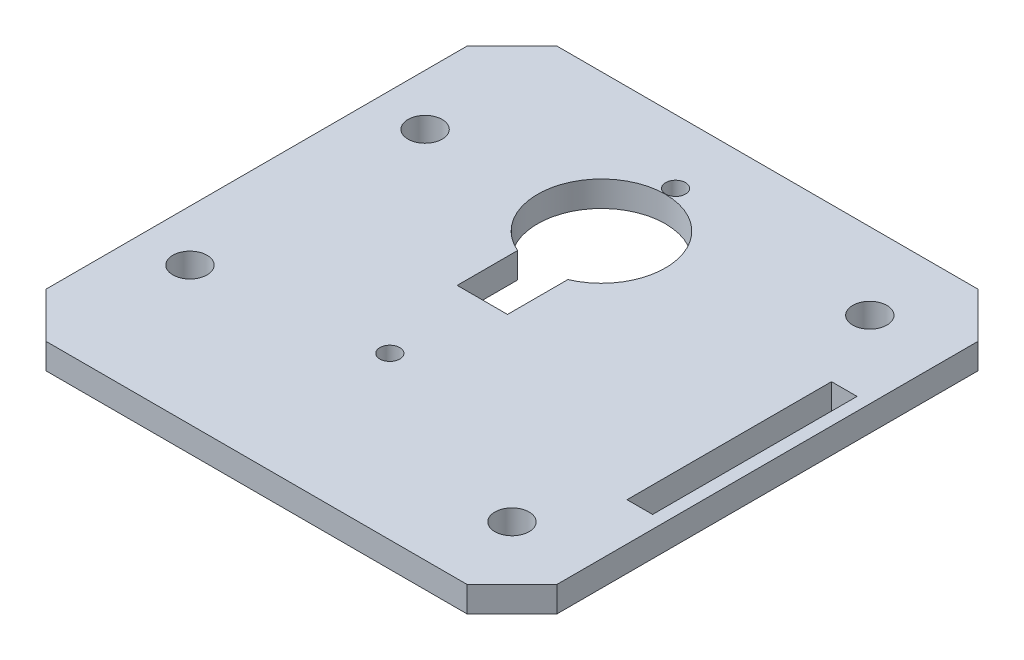
from build123d import *

# Parameters (mm, degrees)
SKETCH1_W                       = 50.8
SKETCH1_H                       = 50.8
BOSS_EXTRUDE1_DEPTH             = 2.54
HOLES_FOR_ARMS_D                = 3.4
HOLES_FOR_STRUCTURE_D           = 3.4
CORNERS_START                   = -2.54
CORNERS_DEPTH                   = 39.550715072
MIRROR_START                    = -2.54
MIRROR_OF_CORNER_2_COPY_1_DEPTH = 39.550715072
SKETCH16_W                      = 2.54
SKETCH16_H                      = 2.54
CUT_EXTRUDE1_DEPTH              = 2.54
SKETCH17_R                      = 1.905
BOSS_EXTRUDE4_DEPTH             = 2.54
SKETCH17_6_R                    = 1.905
CUT_EXTRUDE2_DEPTH              = 37.010715072
SKETCH18_R                      = 0.9906
CUT_EXTRUDE3_DEPTH              = 2.54
SKETCH19_W                      = 2.54
SKETCH19_H                      = 15.24
CUT_EXTRUDE4_DEPTH              = 37.010715072


with BuildPart() as part:
    # Sketch1 → Boss-Extrude1 (new body)
    with BuildSketch(Plane(origin=(0, 0, 0), x_dir=(1, 0, 0), z_dir=(0, 1, 0))):
        Rectangle(SKETCH1_W, SKETCH1_H)
    extrude(amount=BOSS_EXTRUDE1_DEPTH)

    # holes for arms (through all)
    with Locations(Plane(origin=(0, 2.54, 0), x_dir=(1, 0, 0), z_dir=(0, 1, 0))):
        with Locations((-20.32, -11.684), (-20.32, 11.684)):
            Hole(HOLES_FOR_ARMS_D / 2)

    # holes for structure (through all)
    with Locations(Plane(origin=(0, 2.54, 0), x_dir=(1, 0, 0), z_dir=(0, 1, 0))):
        with Locations((17.78, -17.78), (17.78, 17.78)):
            Hole(HOLES_FOR_STRUCTURE_D / 2)

    # Sketch12 → corners (cut)
    with BuildSketch(Plane(origin=(0, 2.54, 0), x_dir=(1, 0, 0), z_dir=(0, 1, 0)).offset(CORNERS_START)):
        Polygon((-25.4, -25.4), (-20.909871939, -25.4), (-25.4, -20.909871939), align=None)
    corners = extrude(amount=CORNERS_DEPTH, mode=Mode.SUBTRACT)

    # mirror of corner: corners across plane
    add(corners.mirror(Plane.ZY), mode=Mode.SUBTRACT)

    # mirror of corner 2: corners across plane
    add(corners.mirror(Plane(origin=(0, 0, 0), x_dir=(1, 0, 0), z_dir=(0, 0, -1))), mode=Mode.SUBTRACT)

    # mirror of corner 2 copy 1 sketch → mirror of corner 2 copy 1 (cut)
    with BuildSketch(Plane(origin=(0, 2.54, 0), x_dir=(-1, 0, 0), z_dir=(0, 1, 0)).offset(MIRROR_START)):
        Polygon((-25.4, -25.4), (-20.909871939, -25.4), (-25.4, -20.909871939), align=None)
    extrude(amount=MIRROR_OF_CORNER_2_COPY_1_DEPTH, mode=Mode.SUBTRACT)

    # Sketch16 → Cut-Extrude1 (cut)
    with BuildSketch(Plane(origin=(0, 2.54, 0), x_dir=(1, 0, 0), z_dir=(0, 1, 0))):
        with Locations((22.86, -8.89)):
            Rectangle(SKETCH16_W, SKETCH16_H)
        with Locations((22.86, 8.89)):
            Rectangle(SKETCH16_W, SKETCH16_H)
    extrude(amount=-CUT_EXTRUDE1_DEPTH, mode=Mode.SUBTRACT)

    # Sketch17 → Boss-Extrude4 (add, through all)
    with BuildSketch(Plane(origin=(0, 2.54, 0), x_dir=(1, 0, 0), z_dir=(0, 1, 0))):
        with Locations((-2.794, 11.684)):
            Circle(SKETCH17_R)
    extrude(amount=-BOSS_EXTRUDE4_DEPTH)

    # Sketch17<6> → Cut-Extrude2 (cut, through all)
    with BuildSketch(Plane(origin=(0, 2.54, 0), x_dir=(1, 0, 0), z_dir=(0, 1, 0))):
        with Locations(Location((-2.794, 11.684, 0), (0, 0, 270))):
            Circle(SKETCH17_6_R)
    extrude(amount=-CUT_EXTRUDE2_DEPTH, mode=Mode.SUBTRACT)

    # Sketch18 → Cut-Extrude3 (cut)
    with BuildSketch(Plane(origin=(0, 2.54, 0), x_dir=(1, 0, 0), z_dir=(0, 1, 0))):
        with Locations(Location((-2.794, 19.05, 0), (0, 0, 270))):
            Circle(SKETCH18_R)
        with Locations(Location((-2.794, -9.3472, 0), (0, 0, 270))):
            Circle(SKETCH18_R)
        with BuildLine():
            Line((-5.294, 5.846834592), (-5.294, -0.153165408))
            Line((-5.294, -0.153165408), (-0.294, -0.153165408))
            Line((-0.294, -0.153165408), (-0.294, 5.846834592))
            ThreePointArc((-0.294, 5.846834592), (-2.794, 18.034), (-5.294, 5.846834592))
        make_face()
    extrude(amount=-CUT_EXTRUDE3_DEPTH, mode=Mode.SUBTRACT)

    # Sketch19 → Cut-Extrude4 (cut, through all)
    with BuildSketch(Plane(origin=(0, 2.54, 0), x_dir=(1, 0, 0), z_dir=(0, 1, 0))):
        with Locations((22.86, 0)):
            Rectangle(SKETCH19_W, SKETCH19_H)
    extrude(amount=-CUT_EXTRUDE4_DEPTH, mode=Mode.SUBTRACT)


solid = part.part
